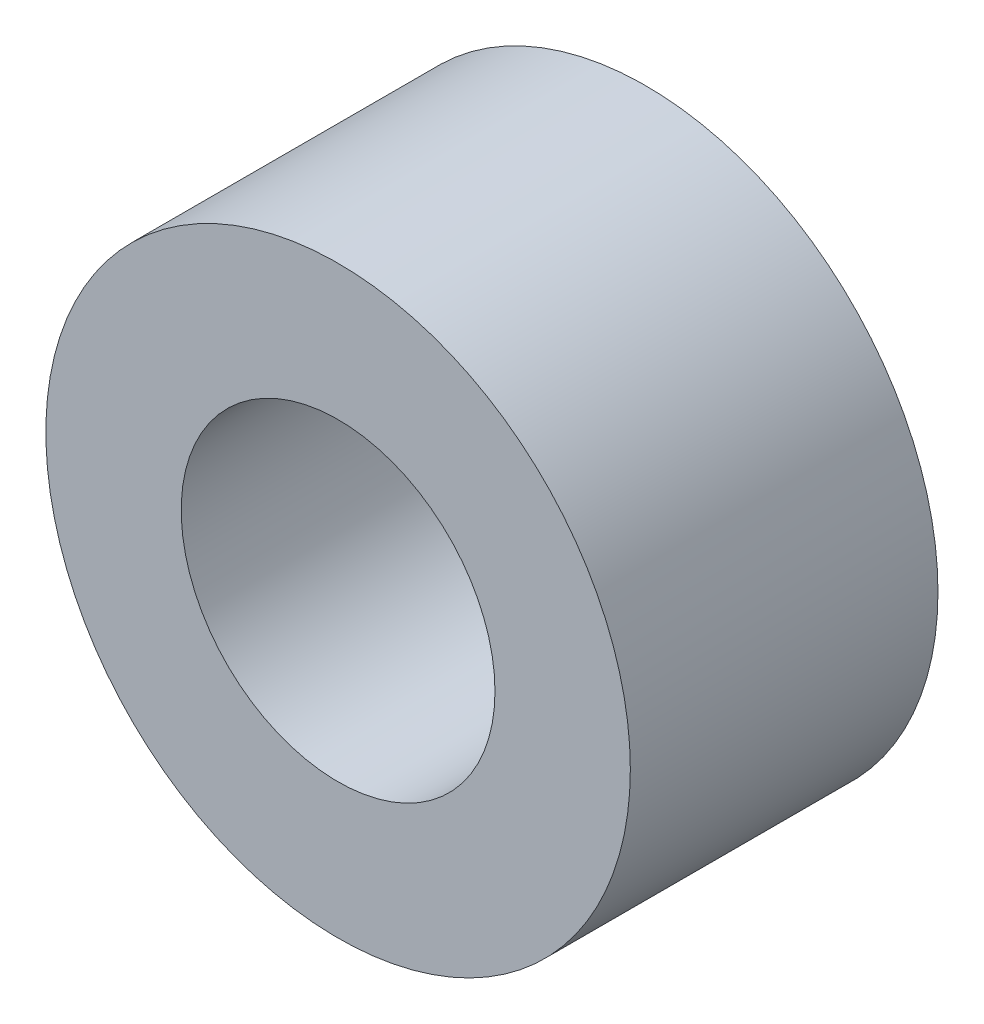
from build123d import *

# Parameters (mm, degrees)
SKETCH_1_R      = 4.75
SKETCH_1_R_2    = 2.55
EXTRUDE_1_DEPTH = 5


with BuildPart() as part:
    # 草图1 → 凸台-拉伸1 (new body)
    with BuildSketch(Plane.XY):
        Circle(SKETCH_1_R)
        Circle(SKETCH_1_R_2, mode=Mode.SUBTRACT)
    extrude(amount=EXTRUDE_1_DEPTH)


solid = part.part
